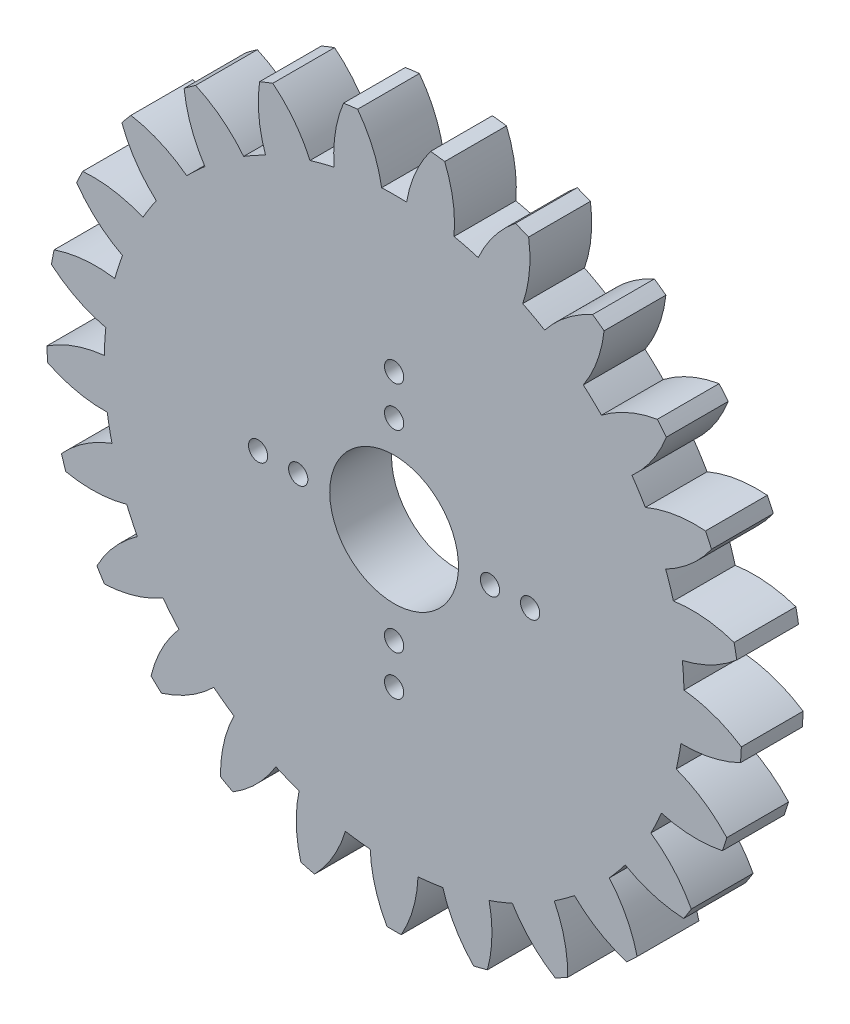
from build123d import *

# Parameters (mm, degrees)
MODEL_R             = 0.475
MODEL_R_2           = 3.175
BOSS_EXTRUDE1_DEPTH = 3.048


with BuildPart() as part:
    # Model → Boss-Extrude1 (new body)
    with BuildSketch(Plane.XY):
        with BuildLine():
            ThreePointArc((6.342950641, 12.816500973), (6.669016568, 14.295057536), (6.635783413, 15.808776154))
            ThreePointArc((6.635783413, 15.808776154), (6.311495456, 15.941017851), (5.984574038, 16.066608185))
            ThreePointArc((5.984574038, 16.066608185), (4.924136412, 14.985904462), (4.149686627, 13.684875627))
            ThreePointArc((4.149686627, 13.684875627), (3.556315124, 13.850932921), (2.956341002, 13.991274707))
            ThreePointArc((2.956341002, 13.991274707), (2.904460903, 15.504468994), (2.495825317, 16.962366609))
            ThreePointArc((2.495825317, 16.962366609), (2.148838289, 17.009806554), (1.800954663, 17.050149187))
            ThreePointArc((1.800954663, 17.050149187), (1.042592722, 15.739677645), (0.616026415, 14.286925194))
            ThreePointArc((0.616026415, 14.286925194), (0, 14.3002), (-0.616026415, 14.286925194))
            ThreePointArc((-0.616026415, 14.286925194), (-1.042592722, 15.739677645), (-1.800954663, 17.050149187))
            ThreePointArc((-1.800954663, 17.050149187), (-2.148838289, 17.009806554), (-2.495825317, 16.962366609))
            ThreePointArc((-2.495825317, 16.962366609), (-2.904460903, 15.504468994), (-2.956341002, 13.991274707))
            ThreePointArc((-2.956341002, 13.991274707), (-3.556315124, 13.850932921), (-4.149686627, 13.684875627))
            ThreePointArc((-4.149686627, 13.684875627), (-4.924136412, 14.985904462), (-5.984574038, 16.066608185))
            ThreePointArc((-5.984574038, 16.066608185), (-6.311495456, 15.941017851), (-6.635783413, 15.808776154))
            ThreePointArc((-6.635783413, 15.808776154), (-6.669016568, 14.295057536), (-6.342950641, 12.816500973))
            ThreePointArc((-6.342950641, 12.816500973), (-6.88917389, 12.531360786), (-7.422606766, 12.222954996))
            ThreePointArc((-7.422606766, 12.222954996), (-8.496278501, 13.290511787), (-9.792160616, 14.073543103))
            ThreePointArc((-9.792160616, 14.073543103), (-10.077578151, 13.870596369), (-10.358790833, 13.661862153))
            ThreePointArc((-10.358790833, 13.661862153), (-10.014533394, 12.187435039), (-9.331009364, 10.836419348))
            ThreePointArc((-9.331009364, 10.836419348), (-9.789160524, 10.424397166), (-10.229137224, 9.993021149))
            ThreePointArc((-10.229137224, 9.993021149), (-11.534568165, 10.760027378), (-12.98446973, 11.196185548))
            ThreePointArc((-12.98446973, 11.196185548), (-13.210449547, 10.928634304), (-13.430917328, 10.656523107))
            ThreePointArc((-13.430917328, 10.656523107), (-12.730800257, 9.314031176), (-11.732766451, 8.175445642))
            ThreePointArc((-11.732766451, 8.175445642), (-12.0740582, 7.662430334), (-12.39293337, 7.135189032))
            ThreePointArc((-12.39293337, 7.135189032), (-13.84809849, 7.553450876), (-15.360916858, 7.615330478))
            ThreePointArc((-15.360916858, 7.615330478), (-15.513259815, 7.299985954), (-15.659129891, 6.981595523))
            ThreePointArc((-15.659129891, 6.981595523), (-14.647144119, 5.85539248), (-13.397310672, 5.000778618))
            ThreePointArc((-13.397310672, 5.000778618), (-13.600298394, 4.419004823), (-13.778035935, 3.829026746))
            ThreePointArc((-13.778035935, 3.829026746), (-15.291501858, 3.872263276), (-16.772181085, 3.555976188))
            ThreePointArc((-16.772181085, 3.555976188), (-16.841314914, 3.212652639), (-16.903421733, 2.867988616))
            ThreePointArc((-16.903421733, 2.867988616), (-15.643154047, 2.02883794), (-14.220052592, 1.511894283))
            ThreePointArc((-14.220052592, 1.511894283), (-14.271981822, 0.897916987), (-14.297413829, 0.282272628))
            ThreePointArc((-14.297413829, 0.282272628), (-15.774083925, -0.052232867), (-17.129587491, -0.726813165))
            ThreePointArc((-17.129587491, -0.726813165), (-17.111168259, -1.076543457), (-17.085609422, -1.425824564))
            ThreePointArc((-17.085609422, -1.425824564), (-15.656247076, -1.92519595), (-14.14929631, -2.071987931))
            ThreePointArc((-14.14929631, -2.071987931), (-14.046904143, -2.679590275), (-13.918432631, -3.282217718))
            ThreePointArc((-13.918432631, -3.282217718), (-15.265522286, -3.973447027), (-16.410678917, -4.963934173))
            ThreePointArc((-16.410678917, -4.963934173), (-16.305863972, -5.298096369), (-16.194245434, -5.630047943))
            ThreePointArc((-16.194245434, -5.630047943), (-14.68560052, -5.758262697), (-13.189487703, -5.525679522))
            ThreePointArc((-13.189487703, -5.525679522), (-12.939207816, -6.088729025), (-12.664905121, -6.640474253))
            ThreePointArc((-12.664905121, -6.640474253), (-13.797771739, -7.644994897), (-14.660627033, -8.889152941))
            ThreePointArc((-14.660627033, -8.889152941), (-14.476002283, -9.1867504), (-14.285337446, -9.480514703))
            ThreePointArc((-14.285337446, -9.480514703), (-12.792203675, -9.229516622), (-11.400935076, -8.632172348))
            ThreePointArc((-11.400935076, -8.632172348), (-11.018493474, -9.115290538), (-10.615595045, -9.581485369))
            ThreePointArc((-10.615595045, -9.581485369), (-11.46305645, -10.836179621), (-11.989394033, -12.255833538))
            ThreePointArc((-11.989394033, -12.255833538), (-11.736560131, -12.498167117), (-11.47882917, -12.735285858))
            ThreePointArc((-11.47882917, -12.735285858), (-10.095025626, -12.120846074), (-8.896019768, -11.196274037))
            ThreePointArc((-8.896019768, -11.196274037), (-8.405446665, -11.569104823), (-7.899268091, -11.920456521))
            ThreePointArc((-7.899268091, -11.920456521), (-8.408075165, -13.346487327), (-8.564823313, -14.85243504))
            ThreePointArc((-8.564823313, -14.85243504), (-8.259666742, -15.024278029), (-7.95106384, -15.189852165))
            ThreePointArc((-7.95106384, -15.189852165), (-6.76353999, -14.25057819), (-5.832134822, -13.056872652))
            ThreePointArc((-5.832134822, -13.056872652), (-5.264254728, -13.295989703), (-4.686601071, -13.510421549))
            ThreePointArc((-4.686601071, -13.510421549), (-4.824783595, -15.018186149), (-4.602093245, -16.515803425))
            ThreePointArc((-4.602093245, -16.515803425), (-4.263788115, -16.606358298), (-3.923703928, -16.689984197))
            ThreePointArc((-3.923703928, -16.689984197), (-3.007076261, -15.484894068), (-2.401795395, -14.097059939))
            ThreePointArc((-2.401795395, -14.097059939), (-1.792290307, -14.187438652), (-1.17945767, -14.251477104))
            ThreePointArc((-1.17945767, -14.251477104), (-0.938333127, -15.746237102), (-0.350196733, -17.14142314))
            ThreePointArc((-0.350196733, -17.14142314), (0, -17.145), (0.350196733, -17.14142314))
            ThreePointArc((0.350196733, -17.14142314), (0.938333127, -15.746237102), (1.17945767, -14.251477104))
            ThreePointArc((1.17945767, -14.251477104), (1.792290307, -14.187438652), (2.401795395, -14.097059939))
            ThreePointArc((2.401795395, -14.097059939), (3.007076261, -15.484894068), (3.923703928, -16.689984197))
            ThreePointArc((3.923703928, -16.689984197), (4.263788115, -16.606358298), (4.602093245, -16.515803425))
            ThreePointArc((4.602093245, -16.515803425), (4.824783595, -15.018186149), (4.686601071, -13.510421549))
            ThreePointArc((4.686601071, -13.510421549), (5.264254728, -13.295989703), (5.832134822, -13.056872652))
            ThreePointArc((5.832134822, -13.056872652), (6.76353999, -14.25057819), (7.95106384, -15.189852165))
            ThreePointArc((7.95106384, -15.189852165), (8.259666742, -15.024278029), (8.564823313, -14.85243504))
            ThreePointArc((8.564823313, -14.85243504), (8.408075165, -13.346487327), (7.899268091, -11.920456521))
            ThreePointArc((7.899268091, -11.920456521), (8.405446665, -11.569104823), (8.896019768, -11.196274037))
            ThreePointArc((8.896019768, -11.196274037), (10.095025626, -12.120846074), (11.47882917, -12.735285858))
            ThreePointArc((11.47882917, -12.735285858), (11.736560131, -12.498167117), (11.989394033, -12.255833538))
            ThreePointArc((11.989394033, -12.255833538), (11.46305645, -10.836179621), (10.615595045, -9.581485369))
            ThreePointArc((10.615595045, -9.581485369), (11.018493474, -9.115290538), (11.400935076, -8.632172348))
            ThreePointArc((11.400935076, -8.632172348), (12.792203675, -9.229516622), (14.285337446, -9.480514703))
            ThreePointArc((14.285337446, -9.480514703), (14.476002283, -9.1867504), (14.660627033, -8.889152941))
            ThreePointArc((14.660627033, -8.889152941), (13.797771739, -7.644994897), (12.664905121, -6.640474253))
            ThreePointArc((12.664905121, -6.640474253), (12.939207816, -6.088729025), (13.189487703, -5.525679522))
            ThreePointArc((13.189487703, -5.525679522), (14.68560052, -5.758262697), (16.194245434, -5.630047943))
            ThreePointArc((16.194245434, -5.630047943), (16.305863972, -5.298096369), (16.410678917, -4.963934173))
            ThreePointArc((16.410678917, -4.963934173), (15.265522286, -3.973447027), (13.918432631, -3.282217718))
            ThreePointArc((13.918432631, -3.282217718), (14.046904143, -2.679590275), (14.14929631, -2.071987931))
            ThreePointArc((14.14929631, -2.071987931), (15.656247076, -1.92519595), (17.085609422, -1.425824564))
            ThreePointArc((17.085609422, -1.425824564), (17.111168259, -1.076543457), (17.129587491, -0.726813165))
            ThreePointArc((17.129587491, -0.726813165), (15.774083925, -0.052232867), (14.297413829, 0.282272628))
            ThreePointArc((14.297413829, 0.282272628), (14.271981822, 0.897916987), (14.220052592, 1.511894283))
            ThreePointArc((14.220052592, 1.511894283), (15.643154047, 2.02883794), (16.903421733, 2.867988616))
            ThreePointArc((16.903421733, 2.867988616), (16.841314914, 3.212652639), (16.772181085, 3.555976188))
            ThreePointArc((16.772181085, 3.555976188), (15.291501858, 3.872263276), (13.778035935, 3.829026746))
            ThreePointArc((13.778035935, 3.829026746), (13.600298394, 4.419004823), (13.397310672, 5.000778618))
            ThreePointArc((13.397310672, 5.000778618), (14.647144119, 5.85539248), (15.659129891, 6.981595523))
            ThreePointArc((15.659129891, 6.981595523), (15.513259815, 7.299985954), (15.360916858, 7.615330478))
            ThreePointArc((15.360916858, 7.615330478), (13.84809849, 7.553450876), (12.39293337, 7.135189032))
            ThreePointArc((12.39293337, 7.135189032), (12.0740582, 7.662430334), (11.732766451, 8.175445642))
            ThreePointArc((11.732766451, 8.175445642), (12.730800257, 9.314031176), (13.430917328, 10.656523107))
            ThreePointArc((13.430917328, 10.656523107), (13.210449547, 10.928634304), (12.98446973, 11.196185548))
            ThreePointArc((12.98446973, 11.196185548), (11.534568165, 10.760027378), (10.229137224, 9.993021149))
            ThreePointArc((10.229137224, 9.993021149), (9.789160524, 10.424397166), (9.331009364, 10.836419348))
            ThreePointArc((9.331009364, 10.836419348), (10.014533394, 12.187435039), (10.358790833, 13.661862153))
            ThreePointArc((10.358790833, 13.661862153), (10.077578151, 13.870596369), (9.792160616, 14.073543103))
            ThreePointArc((9.792160616, 14.073543103), (8.496278501, 13.290511787), (7.422606766, 12.222954996))
            ThreePointArc((7.422606766, 12.222954996), (6.88917389, 12.531360786), (6.342950641, 12.816500973))
        make_face()
        with Locations((0, -6.735)):
            Circle(MODEL_R, mode=Mode.SUBTRACT)
        with Locations((0, -4.755)):
            Circle(MODEL_R, mode=Mode.SUBTRACT)
        with Locations((-6.7095, 0)):
            Circle(MODEL_R, mode=Mode.SUBTRACT)
        with Locations((-4.7295, 0)):
            Circle(MODEL_R, mode=Mode.SUBTRACT)
        Circle(MODEL_R_2, mode=Mode.SUBTRACT)
        with Locations((0, 4.755)):
            Circle(MODEL_R, mode=Mode.SUBTRACT)
        with Locations((0, 6.735)):
            Circle(MODEL_R, mode=Mode.SUBTRACT)
        with Locations((4.7295, 0)):
            Circle(MODEL_R, mode=Mode.SUBTRACT)
        with Locations((6.7095, 0)):
            Circle(MODEL_R, mode=Mode.SUBTRACT)
    extrude(amount=BOSS_EXTRUDE1_DEPTH)


solid = part.part
